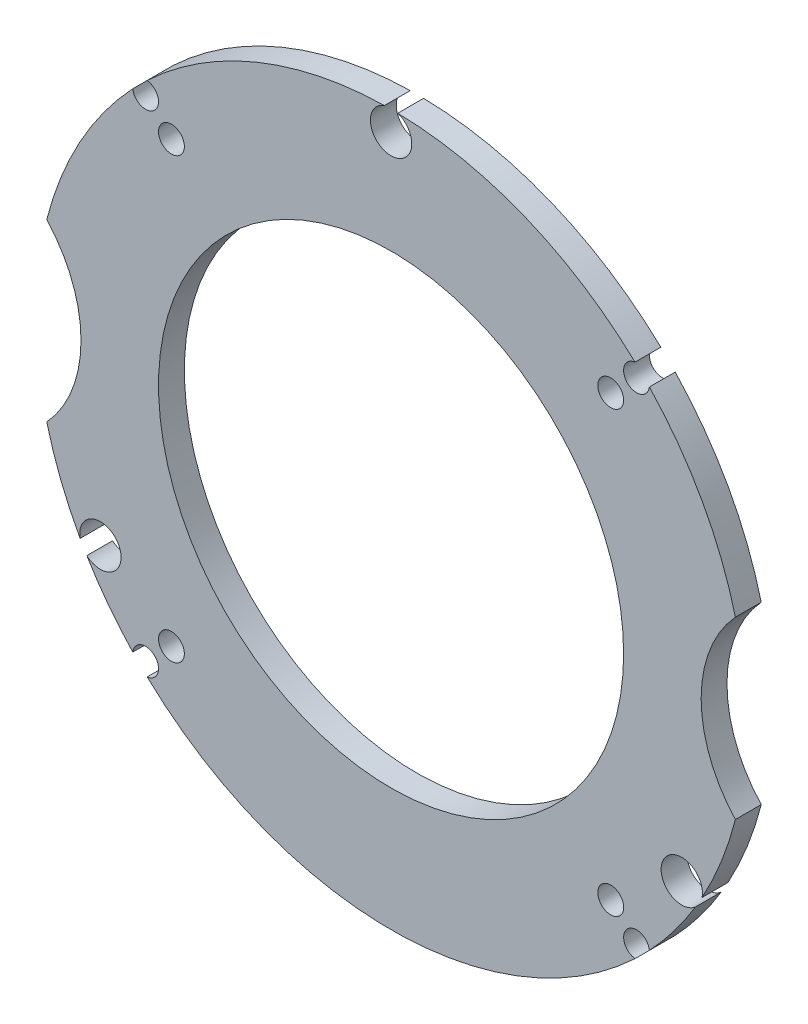
from build123d import *

# Parameters (mm, degrees)
SKETCH1_R             = 18
BOSS_EXTRUDE1_DEPTH   = 2
SKETCH2_R             = 1.6
CUT_EXTRUDE1_DEPTH    = 2
F_2_0MM_DOWEL_HOLE1_D = 2
SKETCH_1_R            = 10
CUT_EXTRUDE_1_DEPTH   = 39.942264957


with BuildPart() as part:
    # Sketch1 → Boss-Extrude1 (new body)
    with BuildSketch(Plane.XY):
        with BuildLine():
            ThreePointArc((-27.5, 0), (0, -27.5), (27.5, 0))
            ThreePointArc((27.5, 0), (0, 27.5), (-27.5, 0))
        make_face()
        Circle(SKETCH1_R, mode=Mode.SUBTRACT)
    extrude(amount=BOSS_EXTRUDE1_DEPTH)

    # Sketch2 → Cut-Extrude1 (cut)
    with BuildSketch(Plane.XY.offset(2)):
        with Locations((0, 25.980762114)):
            Circle(SKETCH2_R)
        with Locations((-22.5, -12.990381057)):
            Circle(SKETCH2_R)
        with Locations((22.5, -12.990381057)):
            Circle(SKETCH2_R)
    extrude(amount=-CUT_EXTRUDE1_DEPTH, mode=Mode.SUBTRACT)

    # Ø2.0mm Dowel Hole1 (through all)
    with Locations(Plane(origin=(-19, 19, 2), x_dir=(1, 0, 0), z_dir=(0, 0, 1))):
        with Locations((0, 0), (2, -2), (36, -2), (38, 0), (36, -36), (38, -38), (0, -38), (2, -36)):
            Hole(F_2_0MM_DOWEL_HOLE1_D / 2)

    # 스케치1 → 컷-돌출1 (cut, through all)
    with BuildSketch(Plane.XY):
        with Locations((-34, 0)):
            Circle(SKETCH_1_R)
        with Locations((34, 0)):
            Circle(SKETCH_1_R)
    extrude(amount=CUT_EXTRUDE_1_DEPTH, mode=Mode.SUBTRACT)


solid = part.part
